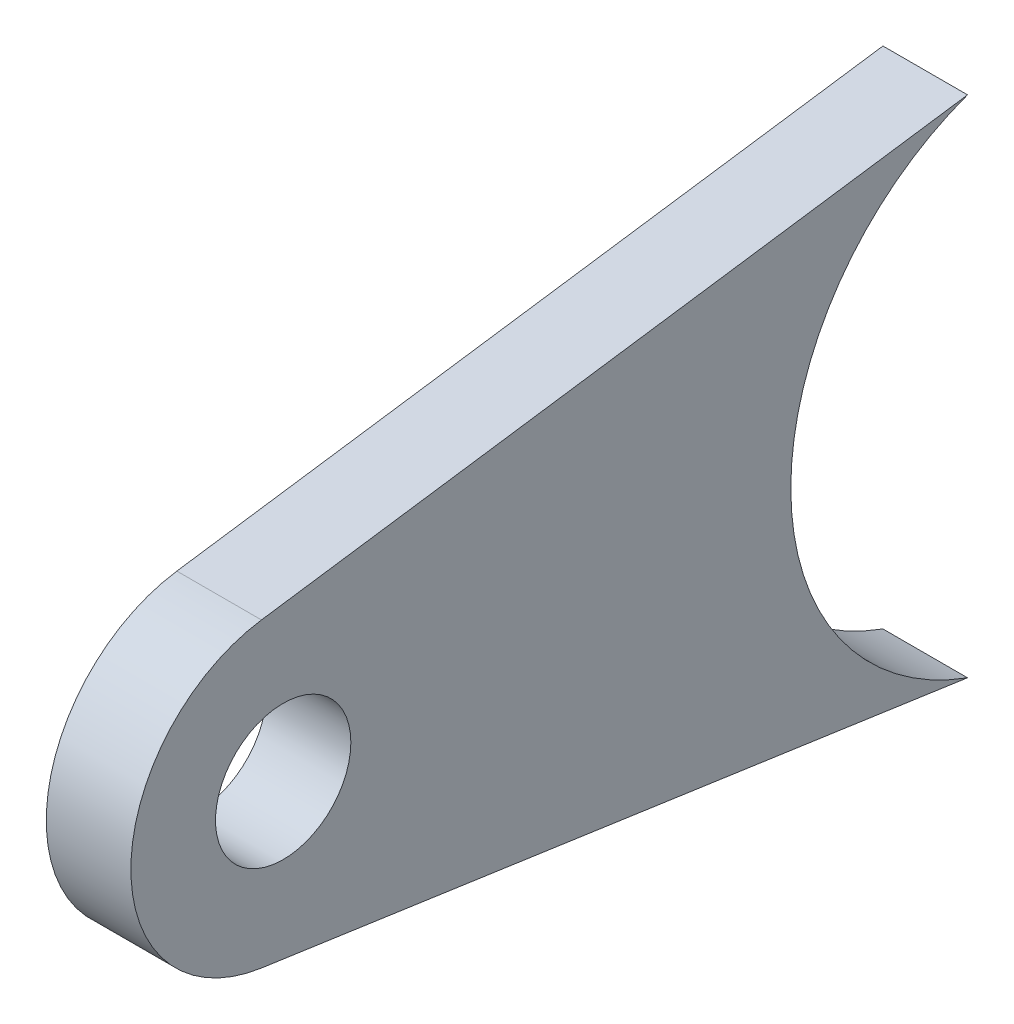
from build123d import *

# Parameters (mm, degrees)
BOSS_EXTRUDE1_DEPTH = 2.5


with BuildPart() as part:
    # Sketch1 → Boss-Extrude1 (new, symmetric)
    with BuildSketch(Plane.YZ):
        with BuildLine():
            ThreePointArc((-14.917620355, 5.429569775), (-9.105525927, 13.004038703), (0, 15.875))
            ThreePointArc((0, 15.875), (9.105525927, 13.004038703), (14.917620355, 5.429569775))
            Line((14.917620355, 5.429569775), (8.908095127, 47.157903431))
            ThreePointArc((8.908095127, 47.157903431), (0, 54.875), (-8.908095127, 47.157903431))
            Line((-8.908095127, 47.157903431), (-14.917620355, 5.429569775))
        make_face()
        with BuildLine():
            ThreePointArc((4, 45.875), (2.828427125, 43.046572875), (0, 41.875))
            ThreePointArc((0, 41.875), (-2.828427125, 48.703427125), (4, 45.875))
        make_face(mode=Mode.SUBTRACT)
    extrude(amount=BOSS_EXTRUDE1_DEPTH, both=True)


solid = part.part
